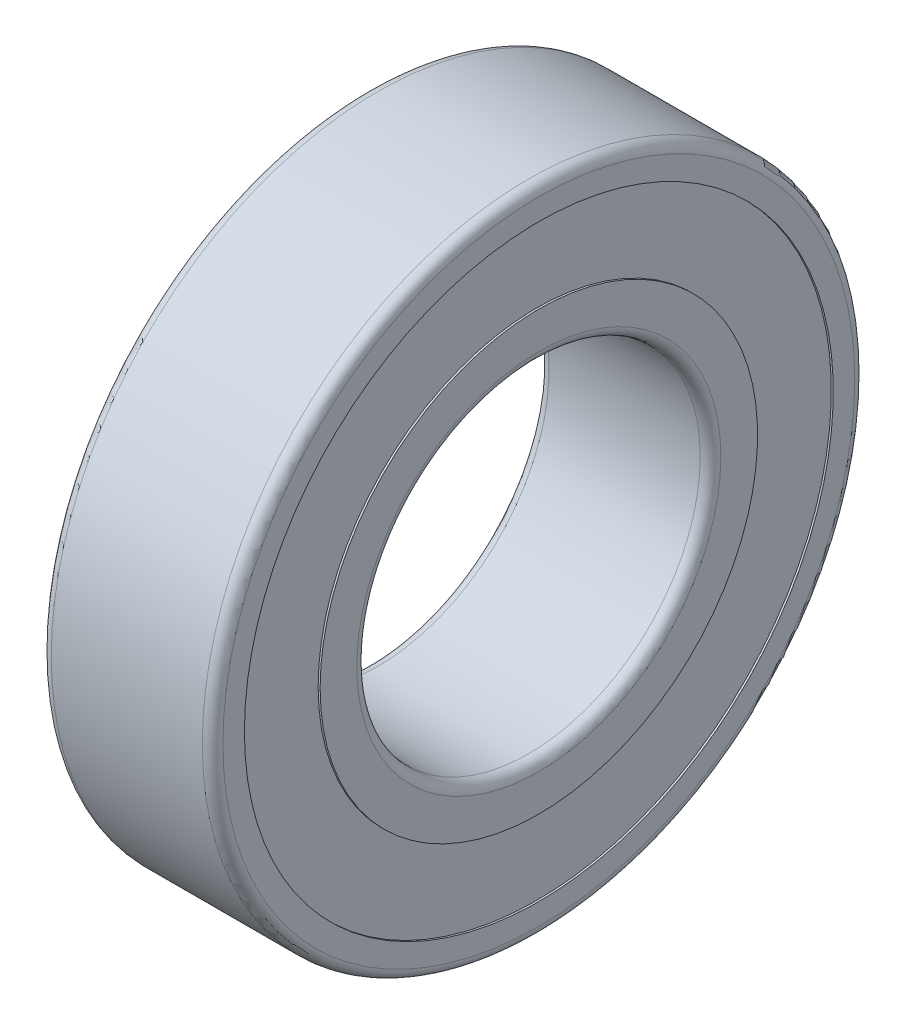
from build123d import *

# Parameters (mm, degrees)
PATTERN_CIRCULAR_5_COUNT = 10
SKETCH_1_3_W             = 0.2
SKETCH_1_3_H             = 2.205
FILLET_1_R               = 0.3
FILLET_2_R               = 0.3


with BuildPart() as part:
    # ｽｹｯﾁ1 → 回転1 (revolve)
    with BuildSketch(Plane.XY):
        with BuildLine():
            Line((0, 8.575), (0, 9.5))
            Line((0, 9.5), (-5, 9.5))
            Line((-5, 9.5), (-5, 8.575))
            Line((-5, 8.575), (-4.7425, 8.575))
            Line((-4.7425, 8.575), (-4.7425, 8.4225))
            Line((-4.7425, 8.4225), (-3.31240384, 8.4225))
            ThreePointArc((-3.31240384, 8.4225), (-2.5, 8.7225), (-1.68759616, 8.4225))
            Line((-1.68759616, 8.4225), (-0.2575, 8.4225))
            Line((-0.2575, 8.4225), (-0.2575, 8.575))
            Line((-0.2575, 8.575), (0, 8.575))
        make_face()
        with BuildLine():
            Line((0, 6.37), (-0.2575, 6.37))
            Line((-0.2575, 6.37), (-0.2575, 6.5225))
            Line((-0.2575, 6.5225), (-1.68759616, 6.5225))
            ThreePointArc((-1.68759616, 6.5225), (-2.5, 6.2225), (-3.31240384, 6.5225))
            Line((-3.31240384, 6.5225), (-4.7425, 6.5225))
            Line((-4.7425, 6.5225), (-4.7425, 6.37))
            Line((-4.7425, 6.37), (-5, 6.37))
            Line((-5, 6.37), (-5, 5))
            Line((-5, 5), (0, 5))
            Line((0, 5), (0, 6.37))
        make_face()
    revolve(axis=Axis((0, 0, 0), (1, 0, 0)))

    # ﾌｨﾚｯﾄ1
    fillet_1_edges = [part.edges().sort_by_distance(p)[0] for p in [
        (0, -5, 0),
        (-5, -5, 0),
    ]]
    fillet(fillet_1_edges, radius=FILLET_1_R)

    # ﾌｨﾚｯﾄ2
    fillet_2_edges = [part.edges().sort_by_distance(p)[0] for p in [
        (-5, -9.5, 0),
        (0, -9.5, 0),
    ]]
    fillet(fillet_2_edges, radius=FILLET_2_R)


with BuildPart() as body_2:
    # ｽｹｯﾁ1<4> → 回転3 (revolve)
    with BuildSketch(Plane.XY):
        with BuildLine():
            ThreePointArc((-1.25, 7.4725), (-1.364657585, 7.99546998), (-1.68759616, 8.4225))
            ThreePointArc((-1.68759616, 8.4225), (-2.5, 8.7225), (-3.31240384, 8.4225))
            ThreePointArc((-3.31240384, 8.4225), (-3.635342415, 7.99546998), (-3.75, 7.4725))
            Line((-3.75, 7.4725), (-1.25, 7.4725))
        make_face()
    revolve(axis=Axis((-5, 7.4725, 0), (1, 0, 0)))


with BuildPart() as pattern_circular_5_1:
    # 円形ﾊﾟﾀｰﾝ5: pattern copy
    add(body_2.part.rotate(Axis((0, 0, 0), (-1, 0, 0)), 1 * 360 / PATTERN_CIRCULAR_5_COUNT))


with BuildPart() as pattern_circular_5_2:
    # 円形ﾊﾟﾀｰﾝ5: pattern copy
    add(body_2.part.rotate(Axis((0, 0, 0), (-1, 0, 0)), 2 * 360 / PATTERN_CIRCULAR_5_COUNT))


with BuildPart() as pattern_circular_5_3:
    # 円形ﾊﾟﾀｰﾝ5: pattern copy
    add(body_2.part.rotate(Axis((0, 0, 0), (-1, 0, 0)), 3 * 360 / PATTERN_CIRCULAR_5_COUNT))


with BuildPart() as pattern_circular_5_4:
    # 円形ﾊﾟﾀｰﾝ5: pattern copy
    add(body_2.part.rotate(Axis((0, 0, 0), (-1, 0, 0)), 4 * 360 / PATTERN_CIRCULAR_5_COUNT))


with BuildPart() as pattern_circular_5_5:
    # 円形ﾊﾟﾀｰﾝ5: pattern copy
    add(body_2.part.rotate(Axis((0, 0, 0), (-1, 0, 0)), 5 * 360 / PATTERN_CIRCULAR_5_COUNT))


with BuildPart() as pattern_circular_5_6:
    # 円形ﾊﾟﾀｰﾝ5: pattern copy
    add(body_2.part.rotate(Axis((0, 0, 0), (-1, 0, 0)), 6 * 360 / PATTERN_CIRCULAR_5_COUNT))


with BuildPart() as pattern_circular_5_7:
    # 円形ﾊﾟﾀｰﾝ5: pattern copy
    add(body_2.part.rotate(Axis((0, 0, 0), (-1, 0, 0)), 7 * 360 / PATTERN_CIRCULAR_5_COUNT))


with BuildPart() as pattern_circular_5_8:
    # 円形ﾊﾟﾀｰﾝ5: pattern copy
    add(body_2.part.rotate(Axis((0, 0, 0), (-1, 0, 0)), 8 * 360 / PATTERN_CIRCULAR_5_COUNT))


with BuildPart() as pattern_circular_5_9:
    # 円形ﾊﾟﾀｰﾝ5: pattern copy
    add(body_2.part.rotate(Axis((0, 0, 0), (-1, 0, 0)), 9 * 360 / PATTERN_CIRCULAR_5_COUNT))


with BuildPart() as body_12:
    # ｽｹｯﾁ1<3> → 回転2 (revolve)
    with BuildSketch(Plane.XY):
        with Locations((-0.1575, 7.4725)):
            Rectangle(SKETCH_1_3_W, SKETCH_1_3_H)
        with Locations((-4.8425, 7.4725)):
            Rectangle(SKETCH_1_3_W, SKETCH_1_3_H)
    revolve(axis=Axis((0, 0, 0), (1, 0, 0)))


solid = Compound([part.part, body_2.part, pattern_circular_5_1.part, pattern_circular_5_2.part, pattern_circular_5_3.part, pattern_circular_5_4.part, pattern_circular_5_5.part, pattern_circular_5_6.part, pattern_circular_5_7.part, pattern_circular_5_8.part, pattern_circular_5_9.part, body_12.part])
